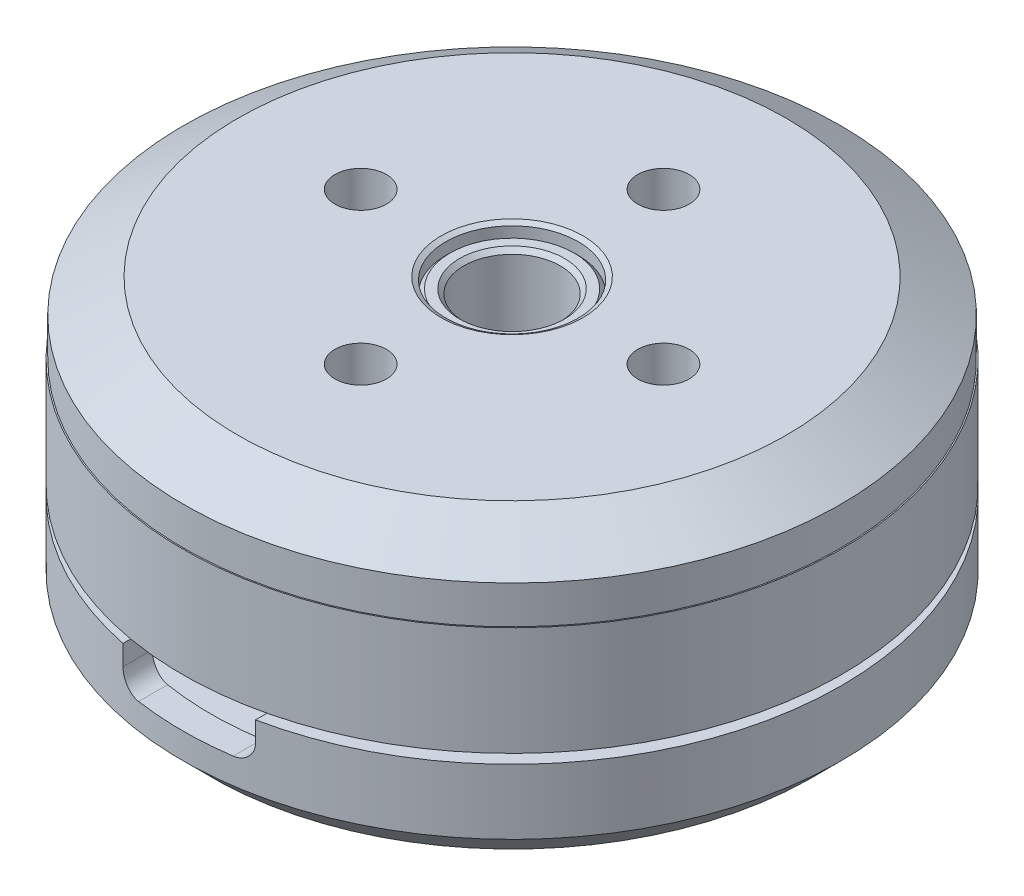
from build123d import *

# Parameters (mm, degrees)
SKETCH4_R          = 1.36
CUT_EXTRUDE1_DEPTH = 4
SKETCH5_R          = 1.36
CUT_EXTRUDE2_DEPTH = 4
SKETCH6_W          = 5.726444475
SKETCH6_H          = 2.29057779
CUT_EXTRUDE3_DEPTH = 3.5
FILLET1_R          = 1


with BuildPart() as part:
    # Sketch1 → Revolve1 (revolve)
    with BuildSketch(Plane(origin=(0, 0, 0), x_dir=(0, 0, -1), z_dir=(1, 0, 0))):
        Polygon((15.9, 0), (3.25, 0), (3.25, -0.75), (3.5, -0.75), (3.5, -1.2), (3.2, -1.5), (2.55, -1.5), (2.55, 14.175), (2.775, 14.4), (3.275, 14.4), (3.5, 14.175), (3.5, 14.805662433), (3.75, 14.95), (14.5, 14.95), (17.35, 13.2), (17.35, 11.2), (17.415, 11.2), (17.415, 5.45), (16.415, 5.45), (16.415, 11.42717663), (12.5, 13.831123999), (12.5, 4.95), (12.5, 2), (15.9, 2), (15.9, 4.95), (17.415, 4.95), (17.415, 1.515), align=None)
    revolve(axis=Axis((0, 0, 0), (0, 1, 0)))

    # Sketch3 → Cut-Revolve1 (revolve, cut)
    with BuildSketch(Plane(origin=(0, 0, 0), x_dir=(0, 0, -1), z_dir=(1, 0, 0))):
        Polygon((5.5, 0), (5.5, -0.625659235), (3.25, -0.071654916), (3.25, 0.040355339), (3.285355339, 0.005), (3.714644661, 0.005), (3.75, 0.040355339), (3.75, 0.065), (5, 0.065), (5, 0.040355339), (5.035355339, 0.005), (5.464644661, 0.005), (5.5, 0.040355339), align=None)
    revolve(axis=Axis((0, 0, 0), (0, 1, 0)), mode=Mode.SUBTRACT)

    # Sketch4 → Cut-Extrude1 (cut)
    with BuildSketch(Plane(origin=(0, 14.95, 0), x_dir=(1, 0, 0), z_dir=(0, 1, 0))):
        with Locations(Location((0, 8, 0), (0, 0, 270))):
            Circle(SKETCH4_R)
        with Locations(Location((8, 0, 0), (0, 0, 270))):
            Circle(SKETCH4_R)
        with Locations(Location((0, -8, 0), (0, 0, 270))):
            Circle(SKETCH4_R)
        with Locations(Location((-8, 0, 0), (0, 0, 270))):
            Circle(SKETCH4_R)
    extrude(amount=-CUT_EXTRUDE1_DEPTH, mode=Mode.SUBTRACT)

    # Sketch5 → Cut-Extrude2 (cut)
    with BuildSketch(Plane.XZ):
        with Locations(Location((-6.717514421, -6.717514421, 0), (0, 0, 270))):
            Circle(SKETCH5_R)
        with Locations(Location((5.656854249, -5.656854249, 0), (0, 0, 270))):
            Circle(SKETCH5_R)
        with Locations(Location((-5.656854249, 5.656854249, 0), (0, 0, 90))):
            Circle(SKETCH5_R)
        with Locations(Location((6.717514421, 6.717514421, 0), (0, 0, 90))):
            Circle(SKETCH5_R)
    extrude(amount=-CUT_EXTRUDE2_DEPTH, mode=Mode.SUBTRACT)

    # Sketch6 → Cut-Extrude3 (cut, symmetric)
    with BuildSketch(Plane(origin=(0, 0, 0), x_dir=(0, 0, -1), z_dir=(1, 0, 0))):
        with Locations((-15.363222238, 4.025390462)):
            Rectangle(SKETCH6_W, SKETCH6_H)
    extrude(amount=CUT_EXTRUDE3_DEPTH, both=True, mode=Mode.SUBTRACT)

    # Fillet1
    fillet1_edges = [part.edges().sort_by_distance(p)[0] for p in [
        (-3.5, 2.880101567, 16.284831695),
        (3.5, 2.880101567, 16.284831695),
    ]]
    fillet(fillet1_edges, radius=FILLET1_R)


solid = part.part
